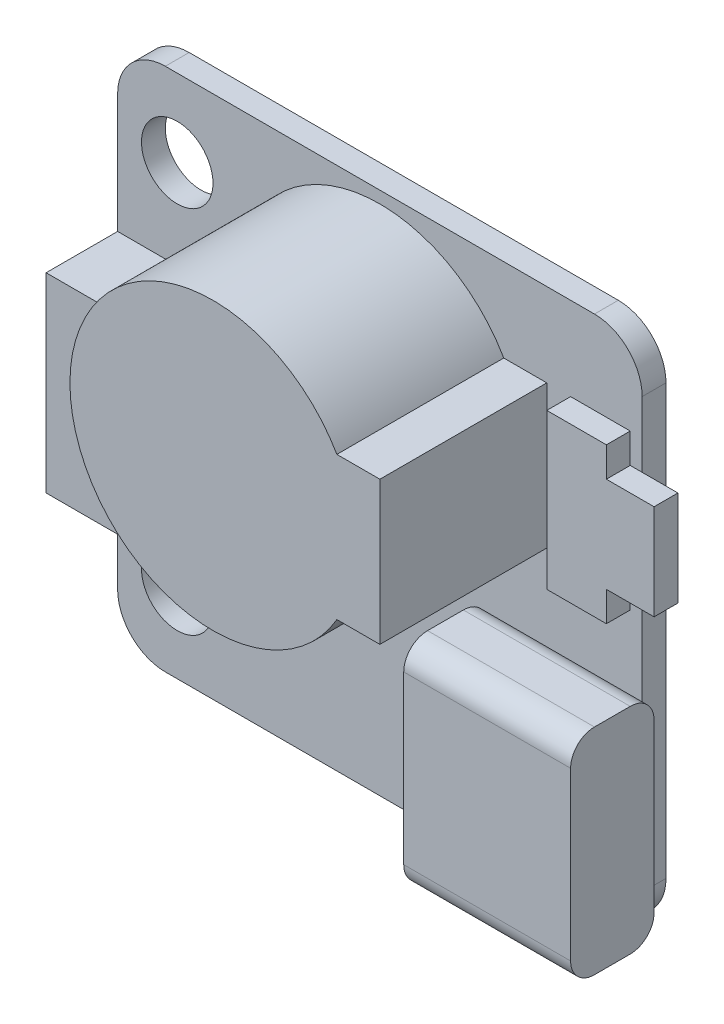
from build123d import *

# Parameters (mm, degrees)
SKETCH1_R                = 1.5
BOSS_EXTRUDE1_DEPTH      = 1
SKETCH2_W                = 4.5
SKETCH2_H                = 8
BOSS_EXTRUDE2_DEPTH      = 3
BOSS_EXTRUDE3_DEPTH      = 7
BOSS_EXTRUDE4_DEPTH      = 0.5
BOSS_EXTRUDE4_DEPTH_BACK = 6.5
SKETCH5_W                = 2.5
SKETCH5_H                = 6.5
SKETCH5_W_2              = 2
SKETCH5_H_2              = 4
BOSS_EXTRUDE5_DEPTH      = 1


with BuildPart() as part:
    # Sketch1 → Boss-Extrude1 (new body)
    with BuildSketch(Plane(origin=(0, 0, 0), x_dir=(0, 1, 0), z_dir=(0, 0, 1))):
        with BuildLine():
            Line((-9, 11), (9, 11))
            ThreePointArc((9, 11), (10.414213562, 10.414213562), (11, 9))
            Line((11, 9), (11, -9))
            ThreePointArc((11, -9), (10.414213562, -10.414213562), (9, -11))
            Line((9, -11), (-9, -11))
            ThreePointArc((-9, -11), (-10.414213562, -10.414213562), (-11, -9))
            Line((-11, -9), (-11, 9))
            ThreePointArc((-11, 9), (-10.414213562, 10.414213562), (-9, 11))
        make_face()
        with Locations(Location((-7.75, 8.5, 0), (0, 0, 270))):
            Circle(SKETCH1_R, mode=Mode.SUBTRACT)
        with Locations(Location((7.75, 8.5, 0), (0, 0, 270))):
            Circle(SKETCH1_R, mode=Mode.SUBTRACT)
    extrude(amount=BOSS_EXTRUDE1_DEPTH)

    # Sketch2 → Boss-Extrude2 (add)
    with BuildSketch(Plane.XY.offset(1)):
        with Locations((-8.75, 0)):
            Rectangle(SKETCH2_W, SKETCH2_H)
    extrude(amount=BOSS_EXTRUDE2_DEPTH)

    # Sketch3 → Boss-Extrude3 (add)
    with BuildSketch(Plane.XY.offset(1)):
        with BuildLine():
            Line((7, 7.5), (5.196152423, 7.5))
            ThreePointArc((5.196152423, 7.5), (-6, 4.5), (5.196152423, 1.5))
            Line((5.196152423, 1.5), (7, 1.5))
            Line((7, 1.5), (7, 7.5))
        make_face()
    extrude(amount=BOSS_EXTRUDE3_DEPTH)

    # Sketch4 → Boss-Extrude4 (add, two sides: drawn at the far end of the back side and taken through both)
    with BuildSketch(Plane.YZ.offset(11).offset(-BOSS_EXTRUDE4_DEPTH_BACK)):
        with BuildLine():
            Line((-9.5, 4.5), (-2.5, 4.5))
            ThreePointArc((-2.5, 4.5), (-1.792893219, 4.207106781), (-1.5, 3.5))
            Line((-1.5, 3.5), (-1.5, 2))
            ThreePointArc((-1.5, 2), (-1.792893219, 1.292893219), (-2.5, 1))
            Line((-2.5, 1), (-9.5, 1))
            ThreePointArc((-9.5, 1), (-10.207106781, 1.292893219), (-10.5, 2))
            Line((-10.5, 2), (-10.5, 3.5))
            ThreePointArc((-10.5, 3.5), (-10.207106781, 4.207106781), (-9.5, 4.5))
        make_face()
    extrude(amount=BOSS_EXTRUDE4_DEPTH + BOSS_EXTRUDE4_DEPTH_BACK)

    # Sketch5 → Boss-Extrude5 (add)
    with BuildSketch(Plane.XY.offset(1)):
        with Locations((9.25, 4.25)):
            Rectangle(SKETCH5_W, SKETCH5_H)
        with Locations((11.5, 4.25)):
            Rectangle(SKETCH5_W_2, SKETCH5_H_2)
    extrude(amount=BOSS_EXTRUDE5_DEPTH)


solid = part.part
